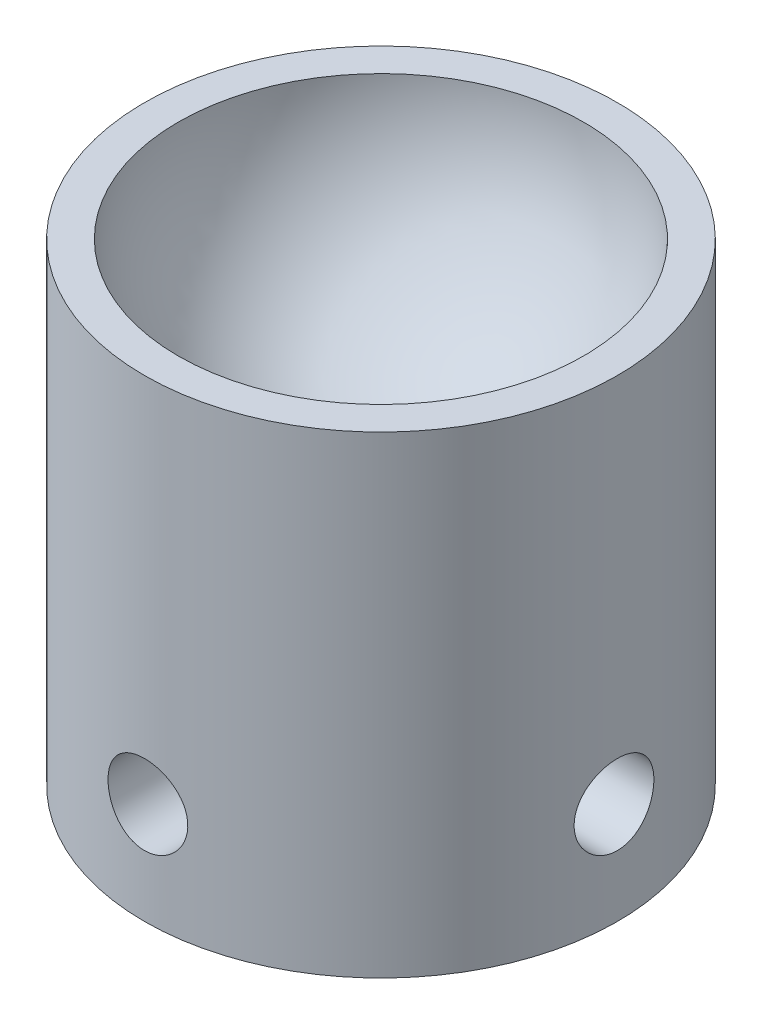
from build123d import *

# Parameters (mm, degrees)
SKETCH1_R           = 8.89
BOSS_EXTRUDE1_DEPTH = 17.78
SKETCH3_R           = 1.5
CUT_EXTRUDE1_DEPTH  = 22.775963813
CIRPATTERN1_COUNT   = 2
CIRPATTERN1_ANGLE   = 90


with BuildPart() as part:
    # Sketch1 → Boss-Extrude1 (new body)
    with BuildSketch(Plane(origin=(0, 0, 0), x_dir=(1, 0, 0), z_dir=(0, 1, 0))):
        with Locations(Location((0, 0, 0), (0, 0, 270))):
            Circle(SKETCH1_R)
    extrude(amount=BOSS_EXTRUDE1_DEPTH)

    # Sketch2 → Cut-Revolve1 (revolve, cut)
    with BuildSketch(Plane.XY):
        with BuildLine():
            Line((0, 10.16), (0, 25.4))
            ThreePointArc((0, 25.4), (-7.62, 17.78), (0, 10.16))
        make_face()
    revolve(axis=Axis((0, 10.16, 0), (0, 1, 0)), mode=Mode.SUBTRACT)

    # Sketch3 → Cut-Extrude1 (cut, symmetric)
    with BuildSketch(Plane.XY):
        with Locations(Location((0, 3.81, 0), (0, 0, 90))):
            Circle(SKETCH3_R)
    cut_extrude1 = extrude(amount=CUT_EXTRUDE1_DEPTH, both=True, mode=Mode.SUBTRACT)

    # CirPattern1: Cut-Extrude1 ×2 about axis
    cirpattern1_axis = Axis((0, 0, 0), (0, 1, 0))
    for i in range(1, CIRPATTERN1_COUNT):
        add(cut_extrude1.rotate(cirpattern1_axis, i * CIRPATTERN1_ANGLE / (CIRPATTERN1_COUNT - 1)), mode=Mode.SUBTRACT)


solid = part.part
